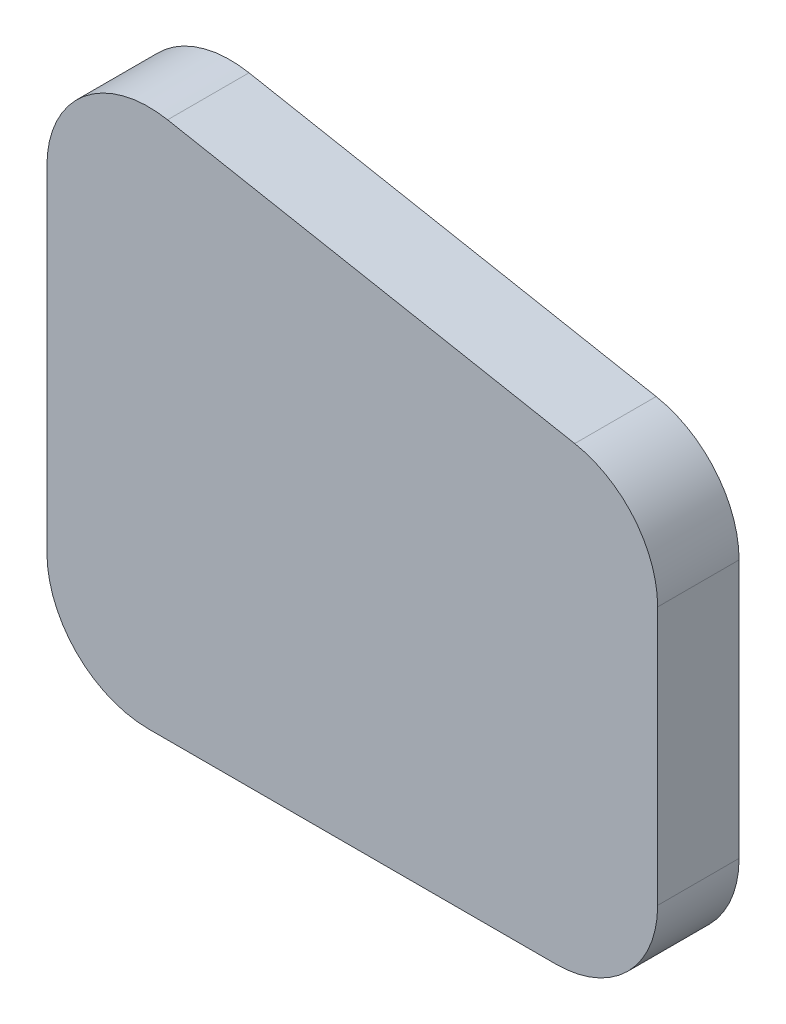
from build123d import *

# Parameters (mm, degrees)
BOSS_EXTRUDE1_DEPTH = 2.54


with BuildPart() as part:
    # Sketch1 → Boss-Extrude1 (new body)
    with BuildSketch(Plane.XY):
        with BuildLine():
            Line((50.730582605, -28.103170966), (63.430582605, -28.103170966))
            ThreePointArc((63.430582605, -28.103170966), (65.675646636, -27.173234997), (66.605582605, -24.928170966))
            Line((66.605582605, -24.928170966), (66.605582605, -16.865797072))
            ThreePointArc((66.605582605, -16.865797072), (65.874858365, -14.839435552), (64.019037087, -13.745805674))
            Line((64.019037087, -13.745805674), (51.319037087, -11.350487557))
            ThreePointArc((51.319037087, -11.350487557), (48.704221085, -12.026203195), (47.555582605, -14.470478955))
            Line((47.555582605, -14.470478955), (47.555582605, -24.928170966))
            ThreePointArc((47.555582605, -24.928170966), (48.485518575, -27.173234997), (50.730582605, -28.103170966))
        make_face()
    extrude(amount=BOSS_EXTRUDE1_DEPTH)


solid = part.part
